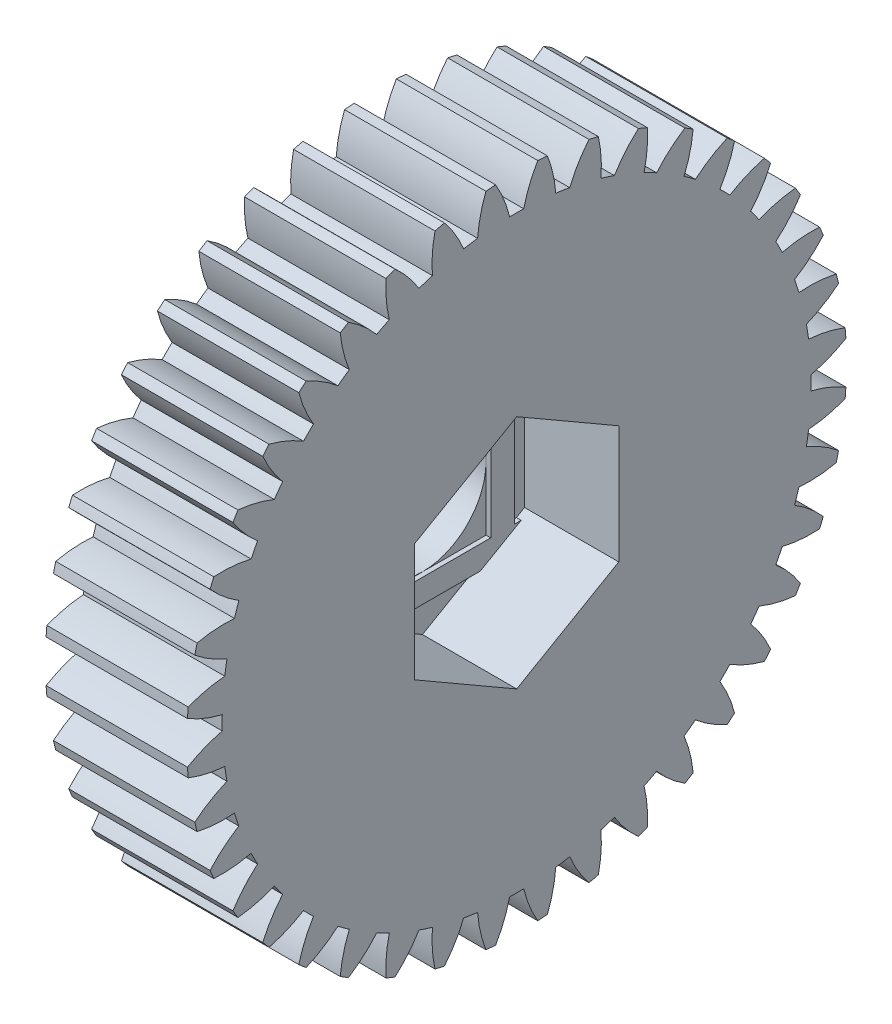
from build123d import *

# Parameters (mm, degrees)
BASPROSKE_W         = 9
BASPROSKE_H         = 21
TOOTHCUT_DEPTH      = 32.032241298
TEETHCUTS_COUNT     = 40
TEETHCUTS_ANGLE     = 351
BORSKE_R            = 2
BORE_DEPTH          = 50.0000508
CUT_EXTRUDE1_DEPTH  = 6
SKETCH1_7_R         = 4.05
CUT_EXTRUDE2_DEPTH  = 31.974304622
SKETCH2_R           = 6
SKETCH2_R_2         = 4
BOSS_EXTRUDE1_DEPTH = 1.8
SKETCH3_W           = 8.1
SKETCH3_H           = 8.1
BOSS_EXTRUDE2_DEPTH = 0.3


with BuildPart() as part:
    # BasProSke → Base-Revolve (revolve)
    with BuildSketch(Plane(origin=(0, 0, 0), x_dir=(1, 0, 0), z_dir=(0, 1, 0)), mode=Mode.PRIVATE) as base_revolve_sk:
        with Locations((4.5, 10.5)):
            Rectangle(BASPROSKE_W, BASPROSKE_H)
    revolve(base_revolve_sk.sketch.rotate(Axis((-10, 0, 0), (1, 0, 0)), 180), axis=Axis((-10, 0, 0), (1, 0, 0)))

    # TooCutSke → ToothCut (cut, through all)
    with BuildSketch(Plane(origin=(0, 0, 0), x_dir=(0, 0, -1), z_dir=(1, 0, 0))):
        with BuildLine():
            ThreePointArc((0.448673268, 18.74363074), (0, 18.749), (-0.448673268, 18.74363074))
            ThreePointArc((-0.448673268, 18.74363074), (-0.816786816, 19.89705013), (-1.354745081, 20.981708961))
            ThreePointArc((-1.354745081, 20.981708961), (0, 21.0254), (1.354745081, 20.981708961))
            ThreePointArc((1.354745081, 20.981708961), (0.816786816, 19.89705013), (0.448673268, 18.74363074))
        make_face()
    toothcut = extrude(amount=TOOTHCUT_DEPTH, mode=Mode.SUBTRACT)

    # TeethCuts: ToothCut ×40 about axis
    teethcuts_axis = Axis((-10, 0, 0), (1, 0, 0))
    for i in range(1, TEETHCUTS_COUNT):
        add(toothcut.rotate(teethcuts_axis, i * TEETHCUTS_ANGLE / (TEETHCUTS_COUNT - 1)), mode=Mode.SUBTRACT)

    # BorSke → Bore (cut, symmetric)
    with BuildSketch(Plane(origin=(0, 0, 0), x_dir=(0, 0, -1), z_dir=(1, 0, 0))):
        with Locations(Location((0, 0, 0), (0, 0, 180))):
            Circle(BORSKE_R)
    extrude(amount=BORE_DEPTH, both=True, mode=Mode.SUBTRACT)

    # Sketch1 → Cut-Extrude1 (cut)
    with BuildSketch(Plane(origin=(9, 0, 0), x_dir=(0, 0, -1), z_dir=(1, 0, 0))):
        Polygon((0, 7.505553499), (-6.5, 3.75277675), (-6.5, -3.75277675), (0, -7.505553499), (6.5, -3.75277675), (6.5, 3.75277675), align=None)
    extrude(amount=-CUT_EXTRUDE1_DEPTH, mode=Mode.SUBTRACT)

    # Sketch1<7> → Cut-Extrude2 (cut, through all)
    with BuildSketch(Plane(origin=(9, 0, 0), x_dir=(0, 0, -1), z_dir=(1, 0, 0))):
        Circle(SKETCH1_7_R)
    extrude(amount=-CUT_EXTRUDE2_DEPTH, mode=Mode.SUBTRACT)

    # Sketch2 → Boss-Extrude1 (add)
    with BuildSketch(Plane.ZY):
        with Locations(Location((0, 0, 0), (0, 0, 180))):
            Circle(SKETCH2_R)
        Circle(SKETCH2_R_2, mode=Mode.SUBTRACT)
    extrude(amount=BOSS_EXTRUDE1_DEPTH)

    # Sketch3 → Boss-Extrude2 (add)
    # profile 1 of 5: a face of its own
    with BuildSketch(Plane(origin=(3, 0, 0), x_dir=(0, 0, -1), z_dir=(1, 0, 0))):
        Polygon((5.55, -4.05), (5.55, 4.05), (5.55, 4.301259505), (3.387118018, 5.55), (-3.387118018, 5.55), (-5.55, 4.301259505), (-5.55, 4.05), (-5.55, -4.05), (-5.55, -4.301259505), (-3.387118018, -5.55), (3.387118018, -5.55), (5.55, -4.301259505), align=None)
        Rectangle(SKETCH3_W, SKETCH3_H, mode=Mode.SUBTRACT)
    # profile 2 of 5: a face of its own
    with BuildSketch(Plane(origin=(3, 0, 0), x_dir=(0, 0, -1), z_dir=(1, 0, 0))):
        Polygon((5.985194229, -4.05), (5.55, -4.05), (5.55, -4.301259505), align=None)
    # profile 3 of 5: a face of its own
    with BuildSketch(Plane(origin=(3, 0, 0), x_dir=(0, 0, -1), z_dir=(1, 0, 0))):
        Polygon((5.55, 4.301259505), (5.55, 4.05), (5.985194229, 4.05), align=None)
    # profile 4 of 5: a face of its own
    with BuildSketch(Plane(origin=(3, 0, 0), x_dir=(0, 0, -1), z_dir=(1, 0, 0))):
        Polygon((-5.55, 4.05), (-5.55, 4.301259505), (-5.985194229, 4.05), align=None)
    # profile 5 of 5: a face of its own
    with BuildSketch(Plane(origin=(3, 0, 0), x_dir=(0, 0, -1), z_dir=(1, 0, 0))):
        Polygon((-5.985194229, -4.05), (-5.55, -4.301259505), (-5.55, -4.05), align=None)
    extrude(amount=BOSS_EXTRUDE2_DEPTH)


solid = part.part
